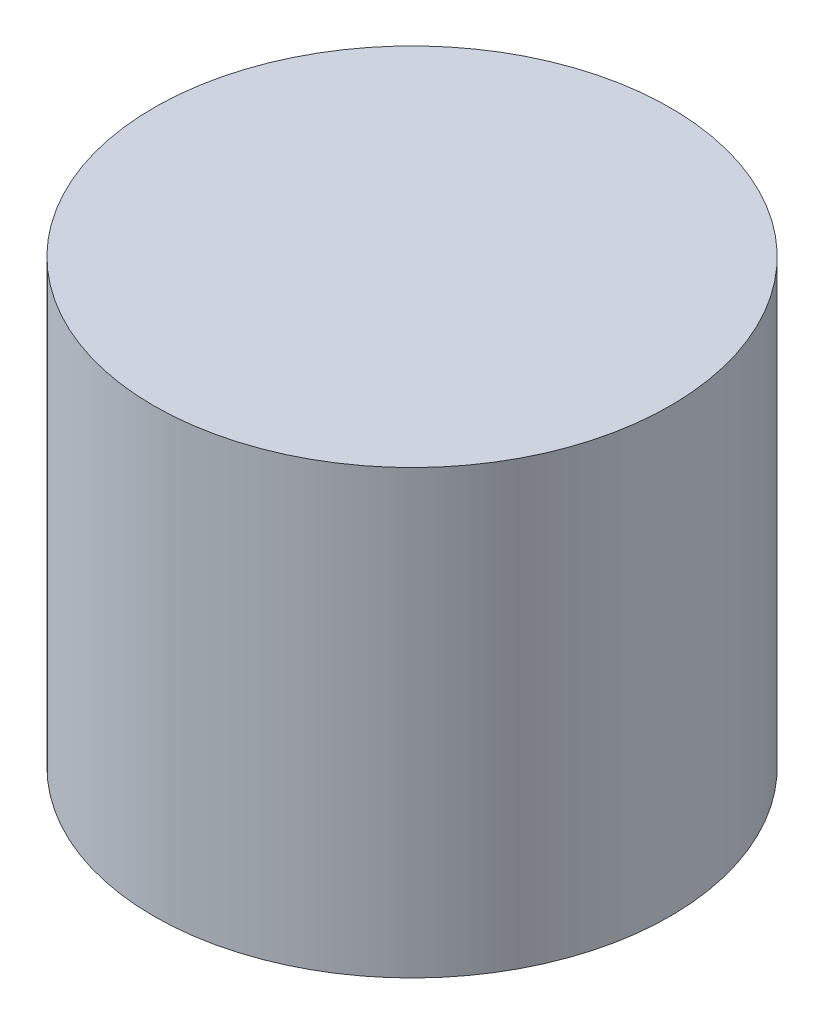
from build123d import *

# Parameters (mm, degrees)
SKETCH1_R           = 12.5
BOSS_EXTRUDE1_DEPTH = 21.4


with BuildPart() as part:
    # Sketch1 → Boss-Extrude1 (new body)
    with BuildSketch(Plane(origin=(0, 0, 0), x_dir=(1, 0, 0), z_dir=(0, 1, 0))):
        with Locations(Location((0, 0, 0), (0, 0, 270))):
            Circle(SKETCH1_R)
    extrude(amount=BOSS_EXTRUDE1_DEPTH)


solid = part.part
